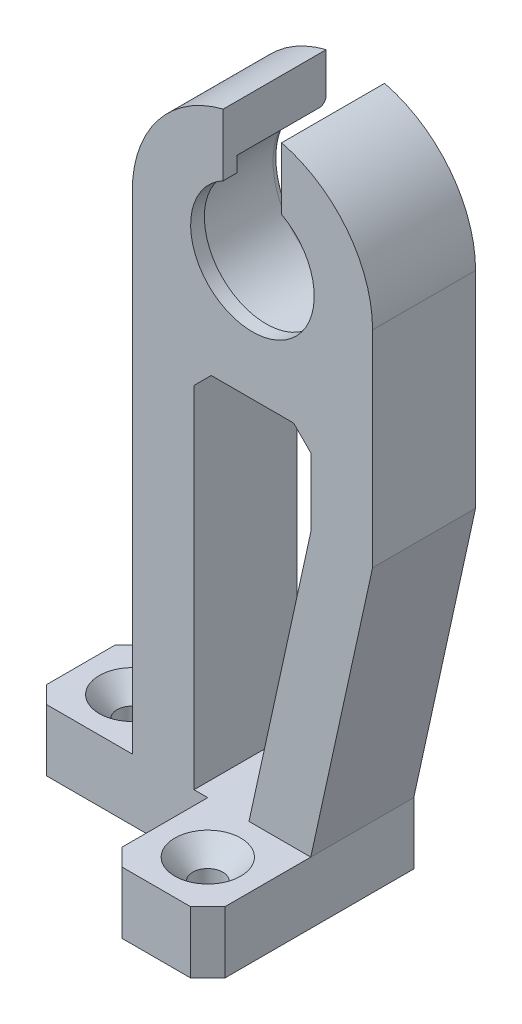
from build123d import *

# Parameters (mm, degrees)
SKETCH1_W           = 15
SKETCH1_H           = 9
BOSS_EXTRUDE1_DEPTH = 15
BOSS_EXTRUDE3_START = 2
BOSS_EXTRUDE3_DEPTH = 2
SKETCH7_W           = 15
SKETCH7_H           = 9
BOSS_EXTRUDE4_DEPTH = 15
FILLET1_R           = 1
CHAMFER1_SIZE       = 2.5


with BuildPart() as part:
    # Sketch1 → Boss-Extrude1 (new body)
    with BuildSketch(Plane.XY):
        with BuildLine():
            ThreePointArc((0, -17.5), (12.374368671, -12.374368671), (17.5, 0))
            Line((17.5, 0), (11, 0))
            ThreePointArc((11, 0), (7.778174593, -7.778174593), (0, -11))
            Line((0, -11), (0, -17.5))
        make_face()
        with BuildLine():
            ThreePointArc((-17.5, 0), (-12.374368671, -12.374368671), (0, -17.5))
            Line((0, -17.5), (0, -11))
            ThreePointArc((0, -11), (-7.778174593, -7.778174593), (-11, 0))
            Line((-11, 0), (-17.5, 0))
        make_face()
        with BuildLine():
            ThreePointArc((-4.25, 16.976086121), (-13.795379661, 10.767427734), (-17.5, 0))
            Line((-17.5, 0), (-11, 0))
            ThreePointArc((-11, 0), (-9.158329542, 6.093028803), (-4.25, 10.145811944))
            Line((-4.25, 10.145811944), (-4.25, 16.976086121))
        make_face()
        with BuildLine():
            Line((11, 0), (17.5, 0))
            ThreePointArc((17.5, 0), (13.795379661, 10.767427734), (4.25, 16.976086121))
            Line((4.25, 16.976086121), (4.25, 10.145811944))
            ThreePointArc((4.25, 10.145811944), (9.158329542, 6.093028803), (11, 0))
        make_face()
        with BuildLine():
            Line((8.5, -71), (17.5, -30))
            Line((17.5, -30), (8.5, -30))
            Line((8.5, -30), (-0.5, -71))
            Line((-0.5, -71), (-8.5, -71))
            Line((-8.5, -71), (-8.5, -17.5))
            Line((-8.5, -17.5), (0, -17.5))
            ThreePointArc((0, -17.5), (-12.374368671, -12.374368671), (-17.5, 0))
            Line((-17.5, 0), (-17.5, -71))
            Line((-17.5, -71), (-17.5, -80))
            Line((-17.5, -80), (8.5, -80))
            Line((8.5, -80), (8.5, -71))
        make_face()
        with BuildLine():
            Line((17.5, -30), (17.5, 0))
            ThreePointArc((17.5, 0), (12.374368671, -12.374368671), (0, -17.5))
            Line((0, -17.5), (8.5, -17.5))
            Line((8.5, -17.5), (8.5, -30))
            Line((8.5, -30), (17.5, -30))
        make_face()
        with Locations((-25, -75.5)):
            Rectangle(SKETCH1_W, SKETCH1_H)
    extrude(amount=BOSS_EXTRUDE1_DEPTH)

    # Sketch6 → Boss-Extrude3 (add)
    with BuildSketch(Plane(origin=(0, 0, 15), x_dir=(-1, 0, 0), z_dir=(0, 0, -1)).offset(BOSS_EXTRUDE3_START)):
        with BuildLine():
            Line((-4.25, 7.933315826), (-4.25, 10.145811944))
            ThreePointArc((-4.25, 10.145811944), (-6.093028803, -9.158329542), (11, 0))
            ThreePointArc((11, 0), (9.158329542, 6.093028803), (4.25, 10.145811944))
            Line((4.25, 10.145811944), (4.25, 7.933315826))
            ThreePointArc((4.25, 7.933315826), (7.721722606, 4.623310502), (9, 0))
            ThreePointArc((9, 0), (-4.623310502, -7.721722606), (-4.25, 7.933315826))
        make_face()
    extrude(amount=-BOSS_EXTRUDE3_DEPTH)

    # Sketch7 → Boss-Extrude4 (add)
    with BuildSketch(Plane.XY.offset(15)):
        with Locations((1, -75.5)):
            Rectangle(SKETCH7_W, SKETCH7_H)
    extrude(amount=BOSS_EXTRUDE4_DEPTH)

    # Sketch11 → Cut-Revolve4 (revolve, cut)
    with BuildSketch(Plane.ZY.offset(25)):
        Polygon((7.5, -71), (7.5, -80), (9.7, -80), (9.7, -74), (12.307860213, -71), align=None)
    revolve(axis=Axis((-25, -71, 7.5), (0, -1, 0)), mode=Mode.SUBTRACT)

    # Sketch10 → Cut-Revolve3 (revolve, cut)
    with BuildSketch(Plane.XY.offset(22.5), mode=Mode.PRIVATE) as cut_revolve3_sk:
        Polygon((1, -71), (5.807860213, -71), (3.2, -74), (3.2, -80), (1, -80), align=None)
    revolve(cut_revolve3_sk.sketch.rotate(Axis((1, -80, 22.5), (0, 1, 0)), 90), axis=Axis((1, -80, 22.5), (0, 1, 0)), mode=Mode.SUBTRACT)

    # Fillet1
    fillet1_edges = [part.edges().sort_by_distance(p)[0] for p in [
        (0, -11, 0),
    ]]
    fillet(fillet1_edges, radius=FILLET1_R)

    # Chamfer1
    chamfer1_edges = [part.edges().sort_by_distance(p)[0] for p in [
        (-32.5, -75.5, 0),
        (-8.5, -17.5, 7.5),
        (8.5, -17.5, 7.5),
        (-32.5, -75.5, 15),
        (-6.5, -75.5, 30),
        (8.5, -75.5, 30),
    ]]
    chamfer(chamfer1_edges, length=CHAMFER1_SIZE)


solid = part.part
